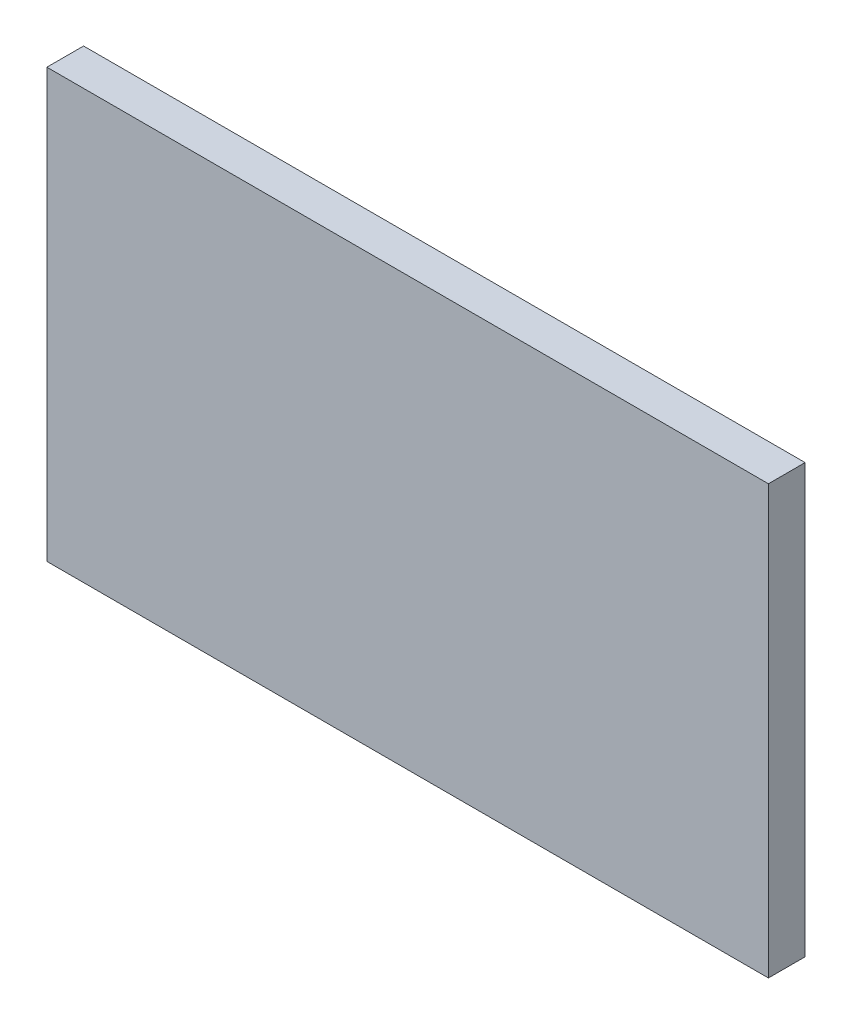
from build123d import *

# Parameters (mm, degrees)
BOSS_EXTRUDE1_DEPTH = 6


with BuildPart() as part:
    # Sketch2 → Boss-Extrude1 (new body)
    with BuildSketch(Plane.XY):
        Polygon((61.131293058, 0), (61.131293058, -35), (-56.868706942, -35), (-56.868706942, 35), (61.131293058, 35), align=None)
    extrude(amount=BOSS_EXTRUDE1_DEPTH)


solid = part.part
